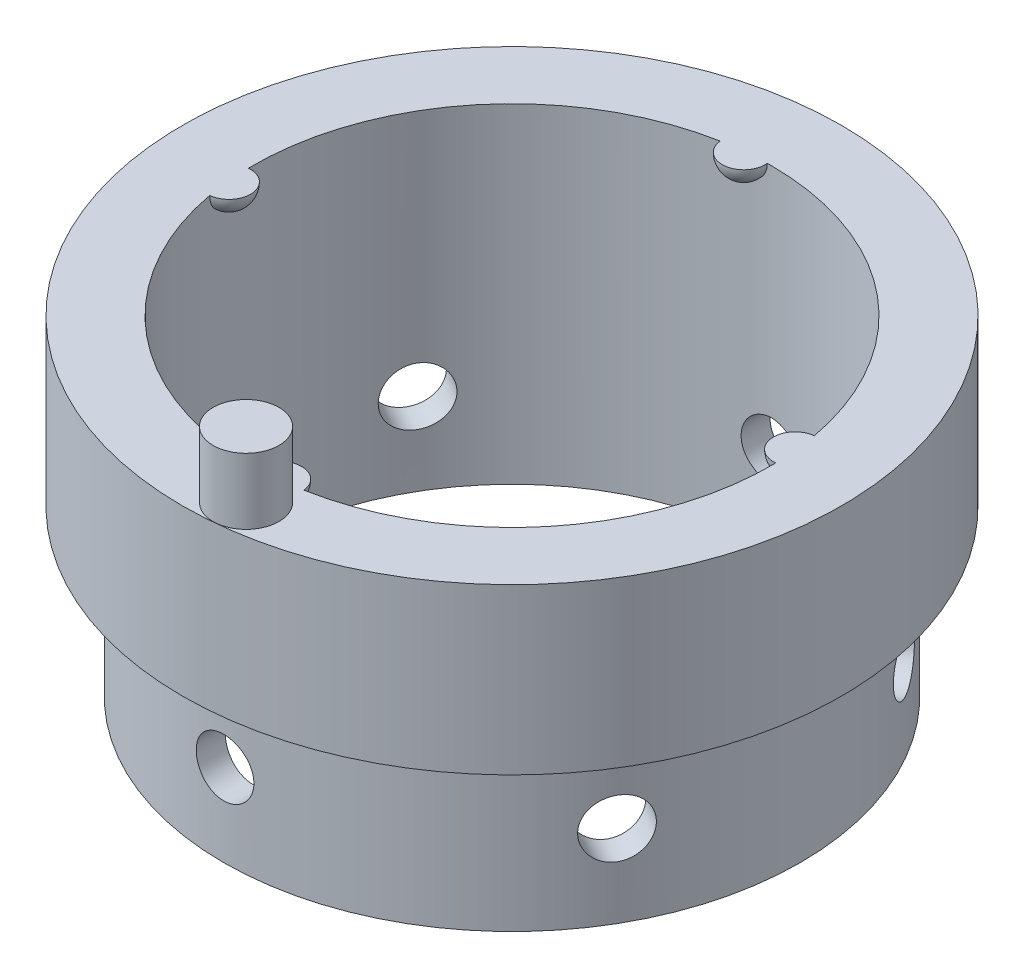
from build123d import *

# Parameters (mm, degrees)
SKETCH8_R           = 4.445
CUT_EXTRUDE2_DEPTH  = 10.16
CIRPATTERN1_COUNT   = 6
SKETCH10_R          = 40.005
CUT_EXTRUDE4_DEPTH  = 125.434078974
REVOLVE4_ANGLE      = 180
CIRPATTERN2_COUNT   = 4
SKETCH16_R          = 5.079288484
BOSS_EXTRUDE1_DEPTH = 10.16


with BuildPart() as part:
    # Sketch1 → Revolve1 (revolve)
    with BuildSketch(Plane(origin=(0, 0, 0), x_dir=(0, 0, -1), z_dir=(1, 0, 0))):
        Polygon((0, 0), (0, -25.4), (6.35, -25.4), (6.35, -50.8), (12.7, -50.8), (12.7, 0), align=None)
    revolve(axis=Axis((0, 24.668312757, -50.8), (0, -1, 0)))

    # Sketch8 → Cut-Extrude2 (cut, symmetric)
    with BuildSketch(Plane.XY.offset(-6.707819403)):
        with Locations(Location((0, -38.1, 0), (0, 0, 270))):
            Circle(SKETCH8_R)
    cut_extrude2 = extrude(amount=CUT_EXTRUDE2_DEPTH, both=True, mode=Mode.SUBTRACT)

    # CirPattern1: Cut-Extrude2 ×6 about axis
    cirpattern1_axis = Axis((0, 24.668312757, -50.8), (0, 1, 0))
    for i in range(1, CIRPATTERN1_COUNT):
        add(cut_extrude2.rotate(cirpattern1_axis, i * 360 / CIRPATTERN1_COUNT), mode=Mode.SUBTRACT)

    # Sketch10 → Cut-Extrude4 (cut, through all)
    with BuildSketch(Plane.XZ.offset(50.8)):
        with Locations(Location((0, -50.8, 0), (0, 0, 270))):
            Circle(SKETCH10_R)
    extrude(amount=-CUT_EXTRUDE4_DEPTH, mode=Mode.SUBTRACT)

    # Sketch14 → Revolve4 (revolve)
    with BuildSketch(Plane(origin=(0, 0, 0), x_dir=(1, 0, 0), z_dir=(0, 1, 0))):
        with BuildLine():
            Line((7.253808844, 11.458135755), (0.649808844, 10.800277833))
            ThreePointArc((0.649808844, 10.800277833), (3.622879883, 14.431206794), (7.253808844, 11.458135755))
        make_face()
    revolve4 = revolve(axis=Axis((0.649808844, 0, -10.800277833), (-0.9950750421165625, 0, 0.09912447001987663)), revolution_arc=REVOLVE4_ANGLE)

    # CirPattern2: Revolve4 ×4 about axis
    cirpattern2_axis = Axis((0, 0, -50.8), (0, 1, 0))
    for i in range(1, CIRPATTERN2_COUNT):
        add(revolve4.rotate(cirpattern2_axis, i * 360 / CIRPATTERN2_COUNT))

    # Sketch16 → Boss-Extrude1 (add)
    with BuildSketch(Plane(origin=(0, 0, 0), x_dir=(1, 0, 0), z_dir=(0, 1, 0))):
        with Locations(Location((4.452646476, 5.350182374, 0), (0, 0, 270))):
            Circle(SKETCH16_R)
    extrude(amount=BOSS_EXTRUDE1_DEPTH)


solid = part.part
